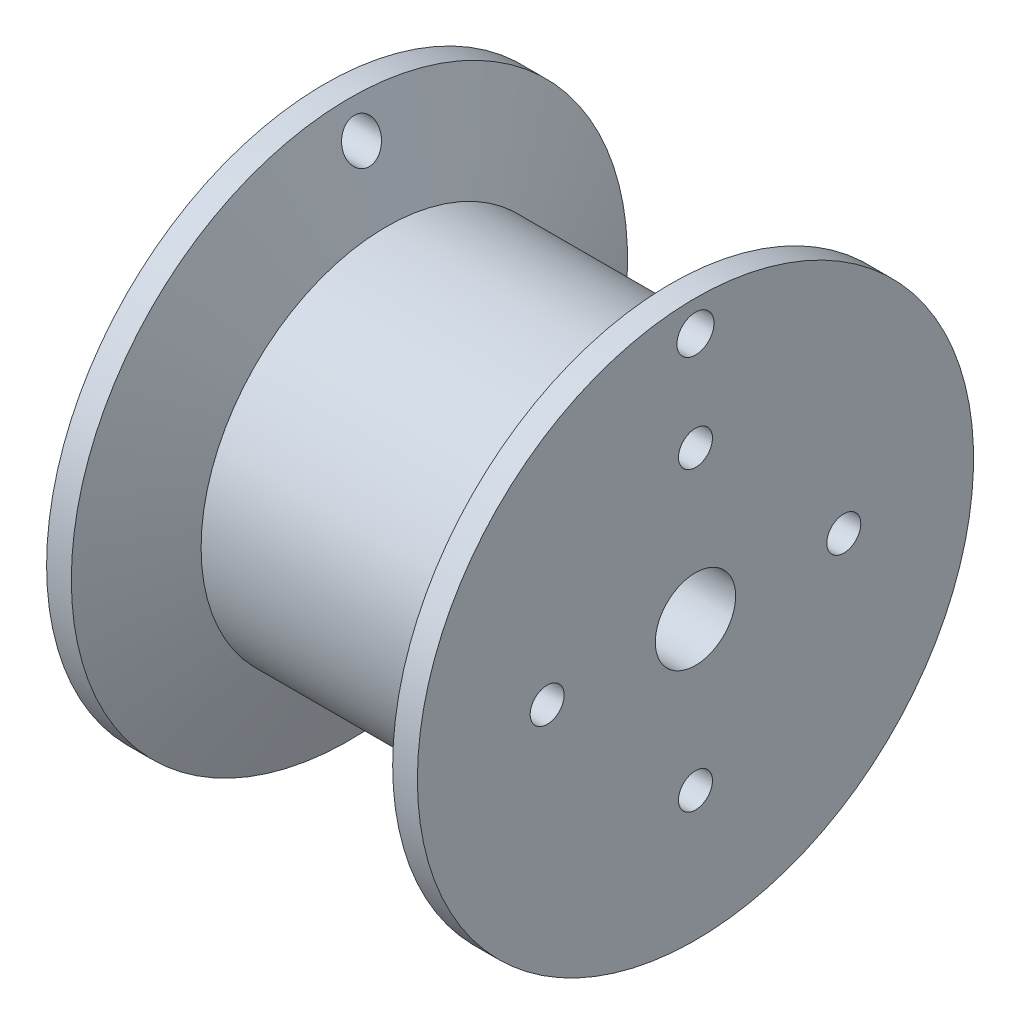
from build123d import *

# Parameters (mm, degrees)
SKETCH2_R          = 1.375
SKETCH2_R_2        = 1.5
CUT_EXTRUDE1_DEPTH = 44.732139211


with BuildPart() as part:
    # Sketch1 → Revolve1 (revolve)
    with BuildSketch(Plane(origin=(0, 0, 0), x_dir=(1, 0, 0), z_dir=(0, 1, 0)), mode=Mode.PRIVATE) as revolve1_sk:
        Polygon((5, 15), (2, 22.5), (0, 22.5), (0, 3.25), (30, 3.25), (30, 22.5), (28, 22.5), (24.995890376, 15), align=None)
    revolve(revolve1_sk.sketch.rotate(Axis((0, 0, 0), (1, 0, 0)), 180), axis=Axis((0, 0, 0), (1, 0, 0)))

    # Sketch2 → Cut-Extrude1 (cut, through all)
    with BuildSketch(Plane(origin=(30, 0, 0), x_dir=(0, 0, -1), z_dir=(1, 0, 0))):
        with Locations((0, 12)):
            Circle(SKETCH2_R)
        with Locations((0, 20)):
            Circle(SKETCH2_R_2)
        with Locations((12, 0)):
            Circle(SKETCH2_R)
        with Locations((0, -12)):
            Circle(SKETCH2_R)
        with Locations((-12, 0)):
            Circle(SKETCH2_R)
    extrude(amount=-CUT_EXTRUDE1_DEPTH, mode=Mode.SUBTRACT)


solid = part.part
